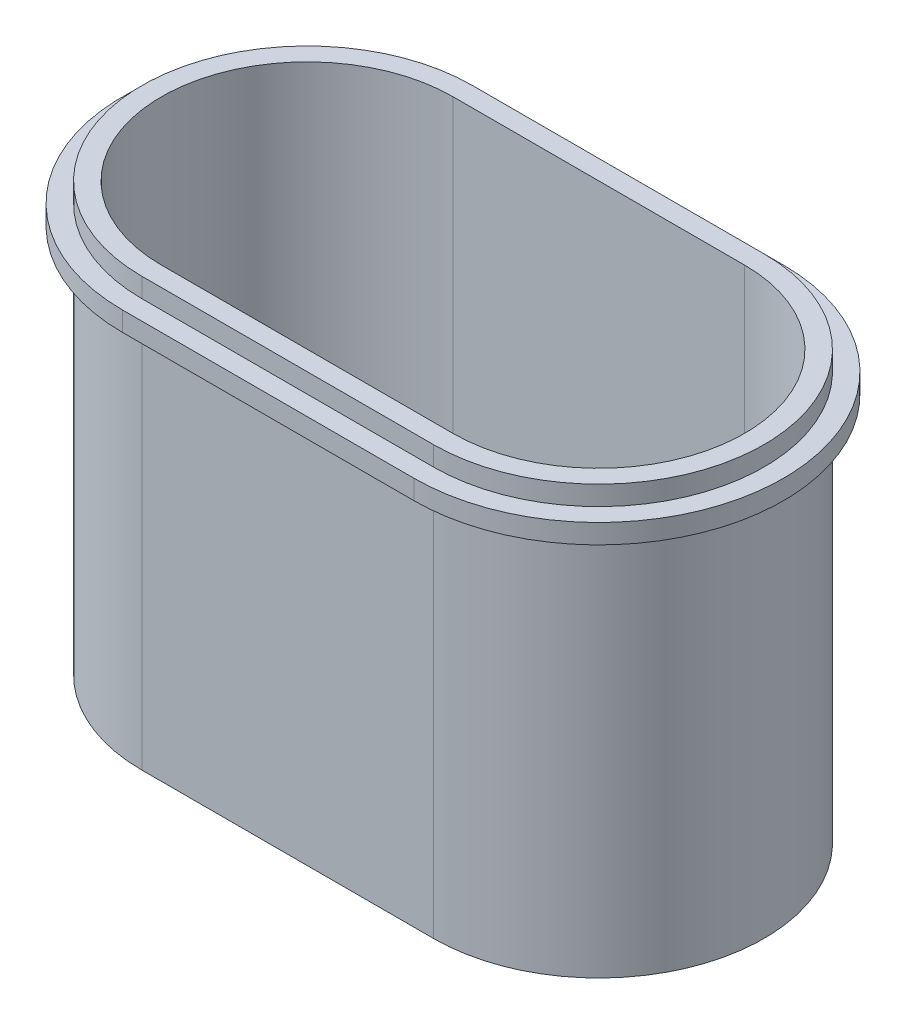
from build123d import *

# Parameters (mm, degrees)
EXTRUDE_1_DEPTH     = 10
EXTRUDE_2_DEPTH     = 10
EXTRUDE_START       = 200
EXTRUDE_3_DEPTH     = 200
CUT_EXTRUDE_1_DEPTH = 294.811163845


with BuildPart() as part:
    # 草图1 → 凸台-拉伸1 (new body)
    with BuildSketch(Plane(origin=(0, 0, 0), x_dir=(1, 0, 0), z_dir=(0, 1, 0))):
        with BuildLine():
            Line((-75, 95), (75, 95))
            ThreePointArc((75, 95), (170, 0), (75, -95))
            Line((75, -95), (-75, -95))
            ThreePointArc((-75, -95), (-170, 0), (-75, 95))
        make_face()
    extrude(amount=EXTRUDE_1_DEPTH)

    # 草图2 → 凸台-拉伸2 (add)
    with BuildSketch(Plane(origin=(0, 10, 0), x_dir=(1, 0, 0), z_dir=(0, 1, 0))):
        with BuildLine():
            Line((-75, 85), (75, 85))
            ThreePointArc((75, 85), (160, 0), (75, -85))
            Line((75, -85), (-75, -85))
            ThreePointArc((-75, -85), (-160, 0), (-75, 85))
        make_face()
    extrude(amount=EXTRUDE_2_DEPTH)

    # 草图3 → 凸台-拉伸3 (add)
    with BuildSketch(Plane.XZ.offset(EXTRUDE_START)):
        with BuildLine():
            Line((-75, -85), (75, -85))
            ThreePointArc((75, -85), (160, 0), (75, 85))
            Line((75, 85), (-75, 85))
            ThreePointArc((-75, 85), (-160, 0), (-75, -85))
        make_face()
    extrude(amount=-EXTRUDE_3_DEPTH)

    # 草图4 → 切除-拉伸1 (cut, through all)
    with BuildSketch(Plane(origin=(0, 20, 0), x_dir=(1, 0, 0), z_dir=(0, 1, 0))):
        with BuildLine():
            Line((-75, 75), (75, 75))
            ThreePointArc((75, 75), (150, 0), (75, -75))
            Line((75, -75), (-75, -75))
            ThreePointArc((-75, -75), (-150, 0), (-75, 75))
        make_face()
    extrude(amount=-CUT_EXTRUDE_1_DEPTH, mode=Mode.SUBTRACT)


solid = part.part
